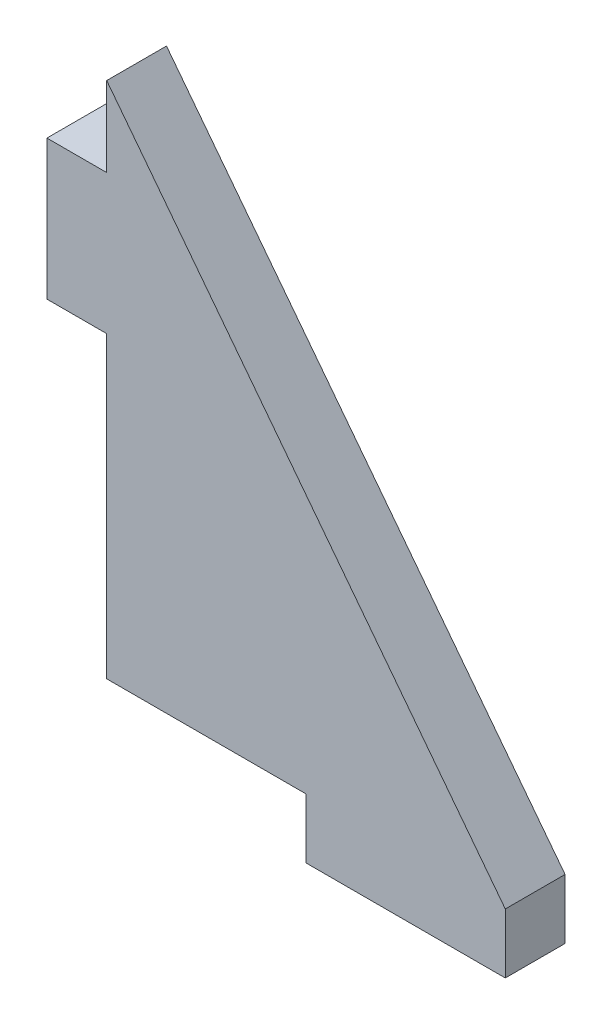
from build123d import *

# Parameters (mm, degrees)
CROQUIS1_W              = 3
CROQUIS1_H              = 7
CROQUIS1_W_2            = 10
CROQUIS1_H_2            = 3
SALIENTE_EXTRUIR1_DEPTH = 3


with BuildPart() as part:
    # Croquis1 → Saliente-Extruir1 (new body)
    with BuildSketch(Plane.XY):
        Polygon((20, 0), (0, 0), (0, 26), align=None)
        with Locations((-1.5, 18.5)):
            Rectangle(CROQUIS1_W, CROQUIS1_H)
        with Locations((15, -1.5)):
            Rectangle(CROQUIS1_W_2, CROQUIS1_H_2)
    extrude(amount=SALIENTE_EXTRUIR1_DEPTH)


solid = part.part
